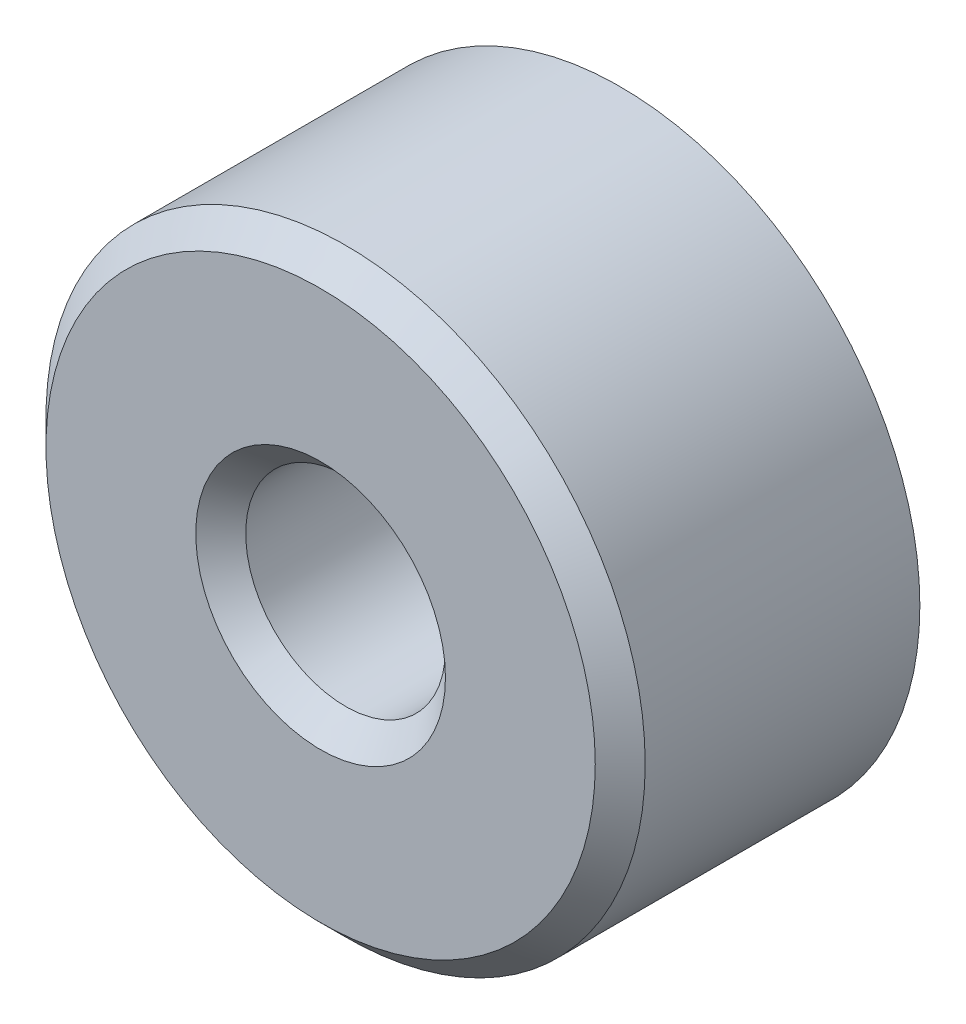
from build123d import *

# Parameters (mm, degrees)
SKETCH1_R           = 3
SKETCH1_R_2         = 1
EXTRUDE_THIN1_DEPTH = 3
CHAMFER1_SIZE       = 0.25
CHAMFER2_SIZE       = 0.25


with BuildPart() as part:
    # Sketch1 → Extrude-Thin1 (new body)
    with BuildSketch(Plane.XY):
        Circle(SKETCH1_R)
        Circle(SKETCH1_R_2, mode=Mode.SUBTRACT)
    extrude(amount=EXTRUDE_THIN1_DEPTH)

    # Chamfer1
    chamfer1_edges = [part.edges().sort_by_distance(p)[0] for p in [
        (-3, 0, 3),
    ]]
    chamfer(chamfer1_edges, length=CHAMFER1_SIZE)

    # Chamfer2
    chamfer2_edges = [part.edges().sort_by_distance(p)[0] for p in [
        (-1, 0, 3),
    ]]
    chamfer(chamfer2_edges, length=CHAMFER2_SIZE)


solid = part.part
